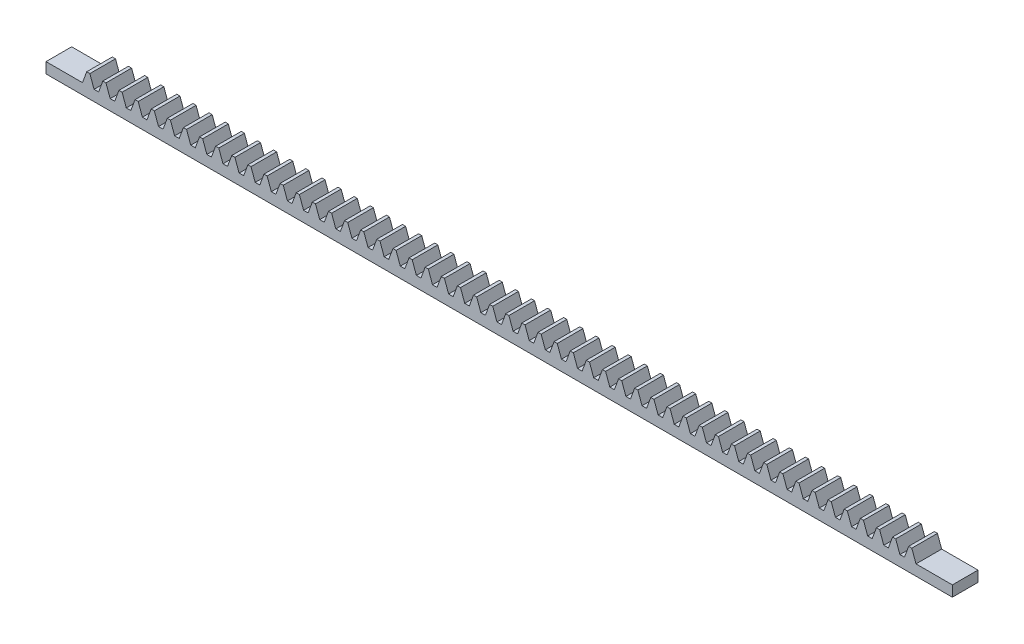
from build123d import *

# Parameters (mm, degrees)
BLANKSKE_W          = 147
BLANKSKE_H          = 2.9
BLANK_DEPTH         = 4.5
TOOTHCUTSIM_DEPTH   = 148.097450692
TEETHCUTS_COUNT     = 53
TEETHCUTS_PITCH     = 2.827433385
SKETCH1_W           = 4.5
SKETCH1_H           = 0.875
BOSS_EXTRUDE1_DEPTH = 6
SKETCH2_W           = 4.5
SKETCH2_H           = 0.875
BOSS_EXTRUDE2_DEPTH = 6
SKETCH3_W           = 159
SKETCH3_H           = 4.5
BOSS_EXTRUDE3_DEPTH = 1


with BuildPart() as part:
    # BlankSke → Blank (new body)
    with BuildSketch(Plane.XY):
        with Locations((73.5, 1.45)):
            Rectangle(BLANKSKE_W, BLANKSKE_H)
    extrude(amount=-BLANK_DEPTH)

    # TooCutSkeSim → ToothCutSim (cut, through all)
    with BuildSketch(Plane.XY):
        Polygon((0.399391833, 0.875), (-0.399391833, 0.875), (-1.145676401, 2.9254), (1.145676401, 2.9254), align=None)
    toothcutsim = extrude(amount=-TOOTHCUTSIM_DEPTH, mode=Mode.SUBTRACT)

    # TeethCuts: ToothCutSim ×53
    with Locations(*[(i * TEETHCUTS_PITCH, 0, 0) for i in range(1, TEETHCUTS_COUNT)]):
        add(toothcutsim, mode=Mode.SUBTRACT)

    # Sketch1 → Boss-Extrude1 (add)
    with BuildSketch(Plane(origin=(147, 0, 0), x_dir=(0, 0, -1), z_dir=(1, 0, 0))):
        with Locations((2.25, 0.4375)):
            Rectangle(SKETCH1_W, SKETCH1_H)
    extrude(amount=BOSS_EXTRUDE1_DEPTH)

    # Sketch2 → Boss-Extrude2 (add)
    with BuildSketch(Plane.ZY):
        with Locations((-2.25, 0.4375)):
            Rectangle(SKETCH2_W, SKETCH2_H)
    extrude(amount=BOSS_EXTRUDE2_DEPTH)

    # Sketch3 → Boss-Extrude3 (add)
    with BuildSketch(Plane.XZ):
        with Locations((73.5, -2.25)):
            Rectangle(SKETCH3_W, SKETCH3_H)
    extrude(amount=BOSS_EXTRUDE3_DEPTH)


solid = part.part
